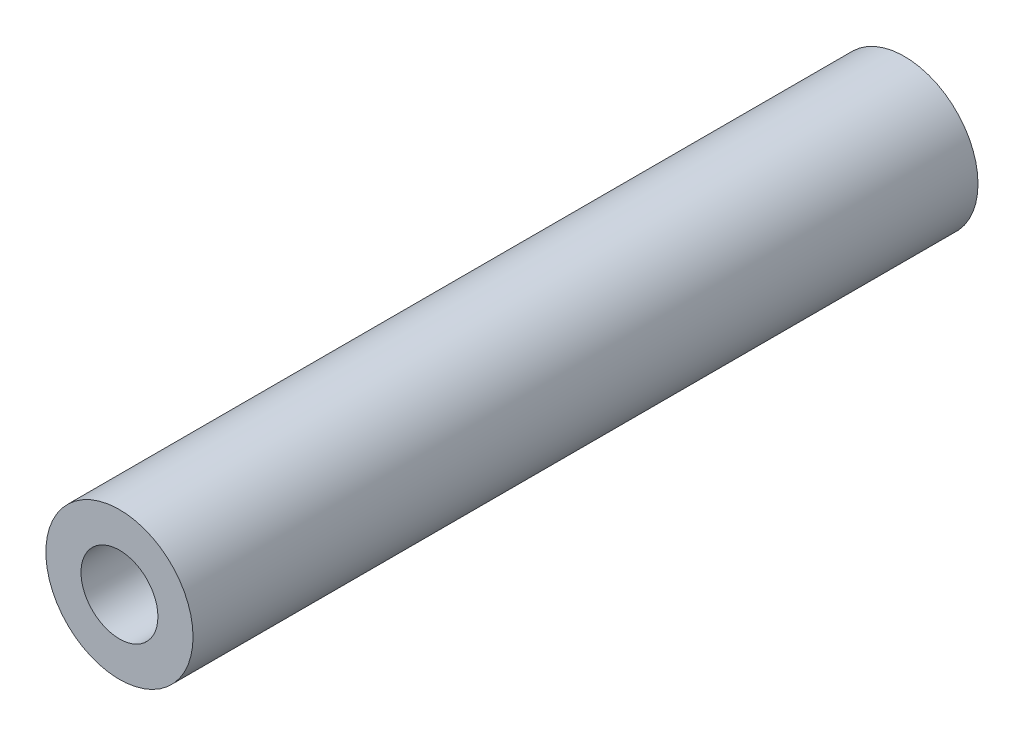
from build123d import *

# Parameters (mm, degrees)
SKETCH1_R           = 4.7625
SKETCH1_R_2         = 2.4892
BOSS_EXTRUDE1_DEPTH = 50.8


with BuildPart() as part:
    # Sketch1 → Boss-Extrude1 (new body)
    with BuildSketch(Plane.XY):
        Circle(SKETCH1_R)
        Circle(SKETCH1_R_2, mode=Mode.SUBTRACT)
    extrude(amount=BOSS_EXTRUDE1_DEPTH)


solid = part.part
